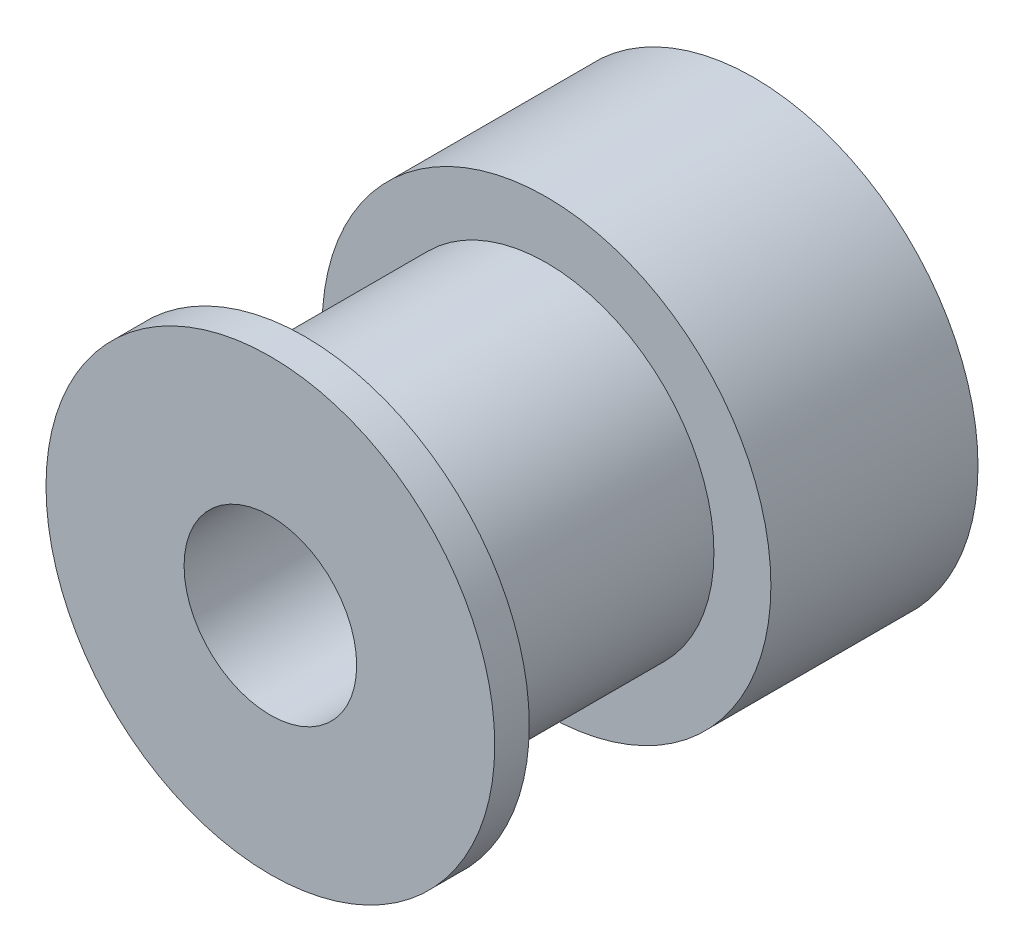
from build123d import *

# Parameters (mm, degrees)
SKETCH_1_R      = 6.5
SKETCH_1_R_2    = 2.5
EXTRUDE_1_DEPTH = 6
SKETCH_2_R      = 4.85
SKETCH_2_R_2    = 2.5
EXTRUDE_2_DEPTH = 7
SKETCH_3_R      = 6.5
SKETCH_3_R_2    = 2.5
EXTRUDE_3_DEPTH = 1


with BuildPart() as part:
    # 草图1 → 凸台-拉伸1 (new body)
    with BuildSketch(Plane.XY):
        Circle(SKETCH_1_R)
        Circle(SKETCH_1_R_2, mode=Mode.SUBTRACT)
    extrude(amount=EXTRUDE_1_DEPTH)

    # 草图2 → 凸台-拉伸2 (add)
    with BuildSketch(Plane.XY.offset(6)):
        Circle(SKETCH_2_R)
        Circle(SKETCH_2_R_2, mode=Mode.SUBTRACT)
    extrude(amount=EXTRUDE_2_DEPTH)

    # 草图3 → 凸台-拉伸3 (add)
    with BuildSketch(Plane.XY.offset(13)):
        Circle(SKETCH_3_R)
        Circle(SKETCH_3_R_2, mode=Mode.SUBTRACT)
    extrude(amount=EXTRUDE_3_DEPTH)


solid = part.part
